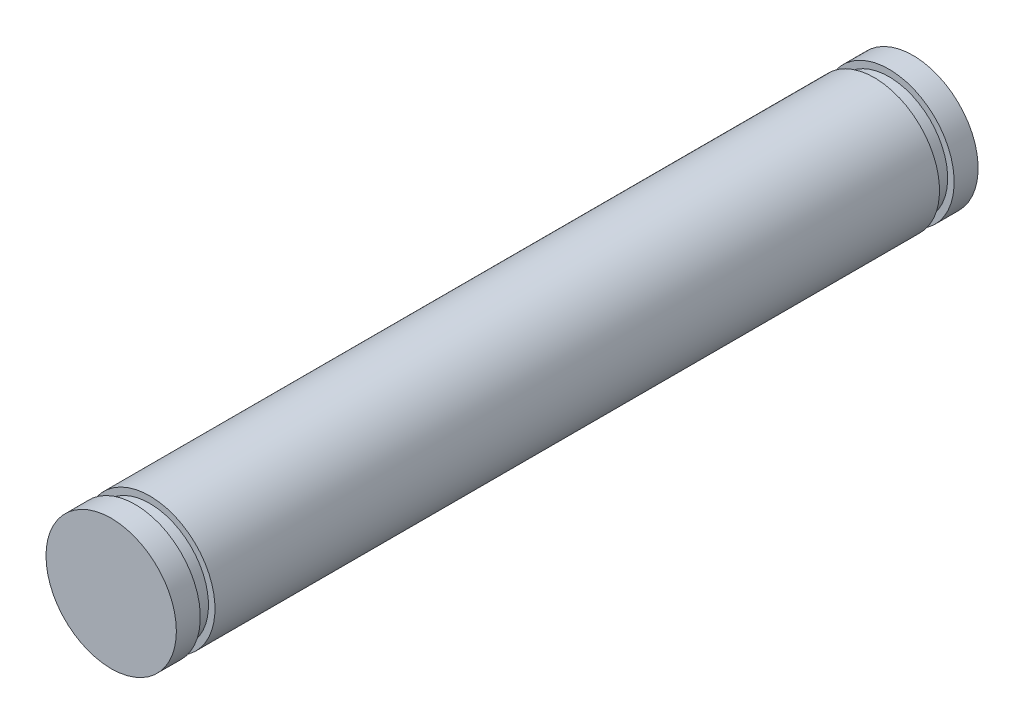
from build123d import *

# Parameters (mm, degrees)
BOSS_EXTRUDE1_DEPTH      = 50
BOSS_EXTRUDE1_DEPTH_BACK = 50
SKETCH3_R                = 4
CHAMFER1_SIZE            = 0.56
SKETCH4_R                = 8.463045105
CUT_EXTRUDE1_DEPTH       = 25.4
SKETCH5_R                = 6.629814771
CUT_EXTRUDE2_DEPTH       = 25.4
CUT_EXTRUDE3_START       = -1.47
SKETCH6_R                = 4
SKETCH6_R_2              = 3.6
CUT_EXTRUDE3_DEPTH       = 0.9


with BuildPart() as part:
    # Sketch3 → Boss-Extrude1 (new, two sides: drawn at the far end of the back side and taken through both)
    with BuildSketch(Plane.XY.offset(-BOSS_EXTRUDE1_DEPTH_BACK)):
        Circle(SKETCH3_R)
    extrude(amount=BOSS_EXTRUDE1_DEPTH + BOSS_EXTRUDE1_DEPTH_BACK)

    # Chamfer1
    chamfer1_edges = [part.edges().sort_by_distance(p)[0] for p in [
        (-4, 0, -50),
        (-4, 0, 50),
    ]]
    chamfer(chamfer1_edges, length=CHAMFER1_SIZE)

    # Sketch4 → Cut-Extrude1 (cut)
    with BuildSketch(Plane.XY.offset(50)):
        Circle(SKETCH4_R)
    extrude(amount=-CUT_EXTRUDE1_DEPTH, mode=Mode.SUBTRACT)

    # Sketch5 → Cut-Extrude2 (cut)
    with BuildSketch(Plane(origin=(0, 0, -50), x_dir=(-1, 0, 0), z_dir=(0, 0, -1))):
        Circle(SKETCH5_R)
    extrude(amount=-CUT_EXTRUDE2_DEPTH, mode=Mode.SUBTRACT)

    # Sketch6 → Cut-Extrude3 (cut)
    with BuildSketch(Plane(origin=(0, 0, -24.6), x_dir=(-1, 0, 0), z_dir=(0, 0, -1)).offset(CUT_EXTRUDE3_START)):
        Circle(SKETCH6_R)
        Circle(SKETCH6_R_2, mode=Mode.SUBTRACT)
    cut_extrude3 = extrude(amount=-CUT_EXTRUDE3_DEPTH, mode=Mode.SUBTRACT)

    # Mirror1: Cut-Extrude3 across plane
    add(cut_extrude3.mirror(Plane(origin=(0, 0, 0), x_dir=(1, 0, 0), z_dir=(0, 0, -1))), mode=Mode.SUBTRACT)


solid = part.part
